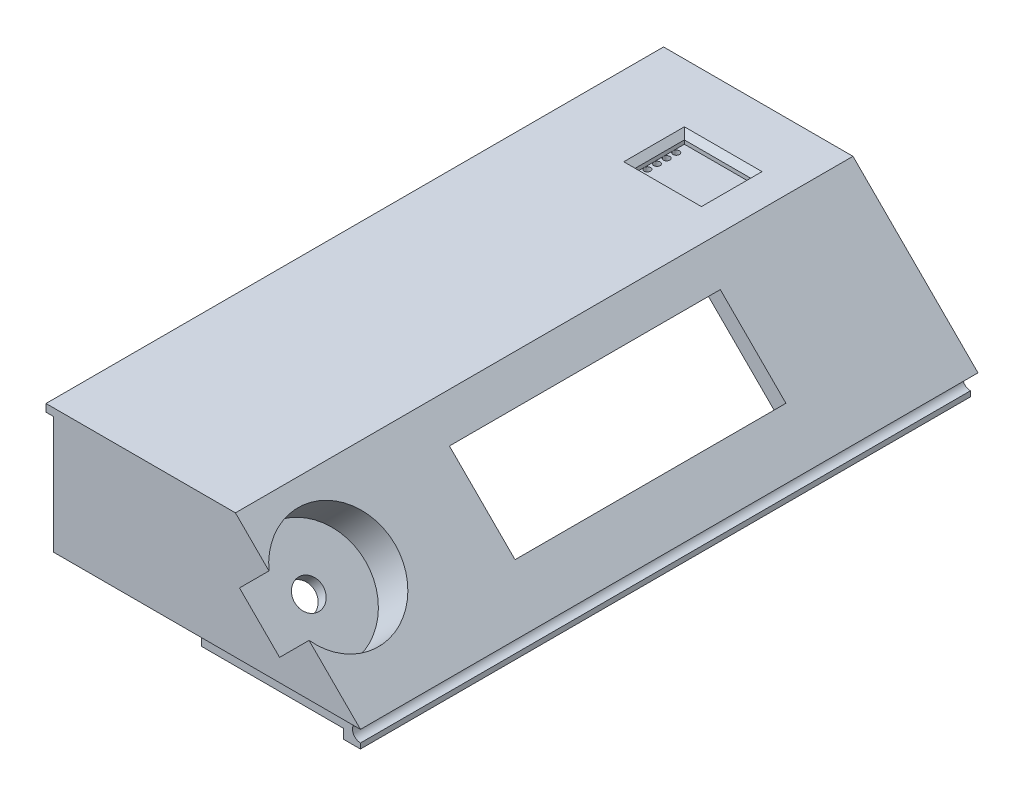
from build123d import *

# Parameters (mm, degrees)
EXTRUDE_1_DEPTH          = 163
EXTRUDE_2_DEPTH          = 2
EXTRUDE_3_DEPTH          = 2
SKETCH_4_W               = 37
SKETCH_4_H               = 10
EXTRUDE_4_DEPTH          = 2
SKETCH_5_W               = 71.5
SKETCH_5_H               = 24.5
CUT_EXTRUDE_1_DEPTH      = 186.248481775
SKETCH_6_W               = 79.5
SKETCH_6_H               = 32.5
SKETCH_6_W_2             = 71.5
SKETCH_6_H_2             = 24.5
EXTRUDE_5_DEPTH          = 3
EXTRUDE_6_DEPTH          = 79.5
SKETCH_10_R              = 15
CUT_EXTRUDE_2_DEPTH      = 14
EXTRUDE_8_DEPTH          = 14
SKETCH_12_R              = 3.75
EXTRUDE_9_DEPTH          = 3
CUT_EXTRUDE_3_DEPTH      = 186.137402806
CUT_EXTRUDE_3_DEPTH_BACK = 186.137402806
SKETCH_14_W              = 17.5
SKETCH_14_H              = 13
SKETCH_15_W              = 23.5
SKETCH_15_H              = 19
SKETCH_15_W_2            = 17.5
SKETCH_15_H_2            = 13
EXTRUDE_10_DEPTH         = 0.5
SKETCH_16_W              = 23.5
SKETCH_16_H              = 19
EXTRUDE_11_DEPTH         = 2
CHAMFER_2_SIZE           = 2
CHAMFER_3_SIZE           = 1.5
SKETCH_17_R              = 0.85
CUT_EXTRUDE_4_DEPTH      = 10
SKETCH_18_W              = 5
SKETCH_18_H              = 7
EXTRUDE_12_DEPTH         = 161
SKETCH_19_R              = 2.1
CUT_EXTRUDE_5_DEPTH      = 161
SKETCH_20_W              = 5
SKETCH_20_H              = 8
EXTRUDE_13_DEPTH         = 22
SKETCH_21_R              = 2.1
CUT_EXTRUDE_6_DEPTH      = 30.1
EXTRUDE_14_DEPTH         = 161
CUT_EXTRUDE_7_DEPTH      = 185.983783073
CUT_EXTRUDE_7_DEPTH_BACK = 185.983783073
SKETCH_23_R              = 2.1
EXTRUDE_15_DEPTH         = 2
EXTRUDE_16_DEPTH         = 6
FILLET_1_R               = 6
CHAMFER_5_SIZE           = 3
CHAMFER_5_SIZE2          = 5.196152423


with BuildPart() as part:
    # Эскиз1 → Бобышка-Вытянуть1 (new body)
    with BuildSketch(Plane.XY):
        Polygon((0, 0), (-31, 31), (-81, 31), (-81, 33), (-31, 33), (2, 0), align=None)
    extrude(amount=EXTRUDE_1_DEPTH)

    # Эскиз2 → Бобышка-Вытянуть2 (add)
    with BuildSketch(Plane.XY.offset(163)):
        Polygon((2, 0), (-31, 33), (-79, 33), (-79, 0), align=None)
    extrude(amount=-EXTRUDE_2_DEPTH)

    # Эскиз3 → Бобышка-Вытянуть3 (add)
    with BuildSketch(Plane(origin=(0, 0, 0), x_dir=(-1, 0, 0), z_dir=(0, 0, -1))):
        Polygon((0, 0), (31, 31), (79, 31), (79, 28), (32.242640687, 28), (4.242640687, 0), align=None)
    extrude(amount=-EXTRUDE_3_DEPTH)

    # Эскиз4 → Бобышка-Вытянуть4 (add)
    with BuildSketch(Plane.XZ):
        with Locations((-60.5, 156)):
            Rectangle(SKETCH_4_W, SKETCH_4_H)
    extrude(amount=-EXTRUDE_4_DEPTH)

    # Эскиз5 → Вырез-Вытянуть1 (cut, through all)
    with BuildSketch(Plane(origin=(1, 1, 0), x_dir=(0, 0, -1), z_dir=(0.7071067811865461, 0.7071067811865489, 0))):
        with Locations((-77.25, 23.840620434)):
            Rectangle(SKETCH_5_W, SKETCH_5_H)
    extrude(amount=-CUT_EXTRUDE_1_DEPTH, mode=Mode.SUBTRACT)

    # Эскиз6 → Бобышка-Вытянуть5 (add)
    with BuildSketch(Plane(origin=(0, 0, 0), x_dir=(0, 0, 1), z_dir=(-0.7071067811865462, -0.7071067811865489, 0))):
        with Locations((77.25, 23.840620434)):
            Rectangle(SKETCH_6_W, SKETCH_6_H)
        with Locations((77.25, 23.840620434)):
            Rectangle(SKETCH_6_W_2, SKETCH_6_H_2, mode=Mode.SUBTRACT)
    extrude(amount=EXTRUDE_5_DEPTH)

    # Эскиз8 → Бобышка-Вытянуть6 (add)
    with BuildSketch(Plane(origin=(0, 0, 37.5), x_dir=(-1, 0, 0), z_dir=(0, 0, -1))):
        Polygon((28.348349571, 28.348349571), (30.469669914, 26.227029227), (35.242640687, 31), (31, 31), align=None)
    extrude(amount=-EXTRUDE_6_DEPTH)

    # Эскиз10 → Вырез-Вытянуть2 (cut)
    with BuildSketch(Plane(origin=(1, 1, 0), x_dir=(0, 0, -1), z_dir=(0.7071067811865461, 0.7071067811865489, 0))):
        with Locations((-150, 25.254833996)):
            Circle(SKETCH_10_R)
    extrude(amount=-CUT_EXTRUDE_2_DEPTH, mode=Mode.SUBTRACT)

    # Эскиз11 → Бобышка-Вытянуть8 (add)
    with BuildSketch(Plane(origin=(1, 1, 0), x_dir=(0, 0, -1), z_dir=(0.7071067811865461, 0.7071067811865489, 0))):
        with BuildLine():
            Line((-163, 32.738148769), (-163, 35.738148769))
            ThreePointArc((-163, 35.738148769), (-133.299703936, 25.254833996), (-163, 14.771519222))
            Line((-163, 14.771519222), (-163, 17.771519222))
            ThreePointArc((-163, 17.771519222), (-135, 25.254833996), (-163, 32.738148769))
        make_face()
    extrude(amount=-EXTRUDE_8_DEPTH)

    # Эскиз12 → Бобышка-Вытянуть9 (add)
    with BuildSketch(Plane(origin=(-8.899494937, -8.899494937, 0), x_dir=(0, 0, -1), z_dir=(0.7071067811865461, 0.7071067811865489, 0))):
        with BuildLine():
            Line((-163, 35.737677122), (-163, 14.77199087))
            ThreePointArc((-163, 14.77199087), (-133.3, 25.254833996), (-163, 35.737677122))
        make_face()
        with Locations(Location((-150, 25.254833996, 0), (0, 0, 270))):
            Circle(SKETCH_12_R, mode=Mode.SUBTRACT)
    extrude(amount=EXTRUDE_9_DEPTH)

    # Эскиз14 → Вырез-Вытянуть3 (cut, two sides: drawn at the far end of the back side and taken through both)
    with BuildSketch(Plane.XZ.offset(-31).offset(-CUT_EXTRUDE_3_DEPTH_BACK)):
        with Locations((-49.75, 23.5)):
            Rectangle(SKETCH_14_W, SKETCH_14_H)
    extrude(amount=CUT_EXTRUDE_3_DEPTH + CUT_EXTRUDE_3_DEPTH_BACK, mode=Mode.SUBTRACT)

    # Эскиз15 → Бобышка-Вытянуть10 (add)
    with BuildSketch(Plane.XZ.offset(-31)):
        with Locations((-49.75, 23.5)):
            Rectangle(SKETCH_15_W, SKETCH_15_H)
        with Locations((-49.75, 23.5)):
            Rectangle(SKETCH_15_W_2, SKETCH_15_H_2, mode=Mode.SUBTRACT)
    extrude(amount=EXTRUDE_10_DEPTH)

    # Эскиз16 → Бобышка-Вытянуть11 (add)
    with BuildSketch(Plane.XZ.offset(-30.5)):
        with Locations((-49.75, 23.5)):
            Rectangle(SKETCH_16_W, SKETCH_16_H)
    extrude(amount=EXTRUDE_11_DEPTH)

    # Фаска2
    chamfer_2_edges = [part.edges().sort_by_distance(p)[0] for p in [
        (-38, 31, 23.5),
        (-49.75, 31, 33),
        (-61.5, 31, 23.5),
        (-49.75, 31, 14),
    ]]
    chamfer(chamfer_2_edges, length=CHAMFER_2_SIZE)

    # Фаска3
    chamfer_3_edges = [part.edges().sort_by_distance(p)[0] for p in [
        (-41, 33, 23.5),
        (-49.75, 33, 17),
        (-58.5, 33, 23.5),
        (-49.75, 33, 30),
    ]]
    chamfer(chamfer_3_edges, length=CHAMFER_3_SIZE)

    # Эскиз17 → Вырез-Вытянуть4 (cut)
    with BuildSketch(Plane(origin=(0, 30.5, 0), x_dir=(1, 0, 0), z_dir=(0, 1, 0))):
        with Locations(Location((-57.65, -20, 0), (0, 0, 270))):
            Circle(SKETCH_17_R)
        with Locations(Location((-57.65, -22.54, 0), (0, 0, 270))):
            Circle(SKETCH_17_R)
        with Locations(Location((-57.65, -25.08, 0), (0, 0, 270))):
            Circle(SKETCH_17_R)
        with Locations(Location((-57.65, -27.62, 0), (0, 0, 270))):
            Circle(SKETCH_17_R)
    extrude(amount=-CUT_EXTRUDE_4_DEPTH, mode=Mode.SUBTRACT)

    # Эскиз18 → Бобышка-Вытянуть12 (add)
    with BuildSketch(Plane(origin=(0, 0, 161), x_dir=(-1, 0, 0), z_dir=(0, 0, -1))):
        with Locations((76.5, 27.5)):
            Rectangle(SKETCH_18_W, SKETCH_18_H)
    extrude(amount=EXTRUDE_12_DEPTH)

    # Эскиз19 → Вырез-Вытянуть5 (cut)
    with BuildSketch(Plane(origin=(0, 0, 0), x_dir=(-1, 0, 0), z_dir=(0, 0, -1))):
        with Locations((79, 28)):
            Circle(SKETCH_19_R)
    extrude(amount=-CUT_EXTRUDE_5_DEPTH, mode=Mode.SUBTRACT)

    # Эскиз20 → Бобышка-Вытянуть13 (add)
    with BuildSketch(Plane.XZ.offset(-24)):
        with Locations((-76.5, 157)):
            Rectangle(SKETCH_20_W, SKETCH_20_H)
    extrude(amount=EXTRUDE_13_DEPTH)

    # Эскиз21 → Вырез-Вытянуть6 (cut)
    with BuildSketch(Plane.XZ):
        with Locations((-79, 159)):
            Circle(SKETCH_21_R)
    extrude(amount=-CUT_EXTRUDE_6_DEPTH, mode=Mode.SUBTRACT)

    # Эскиз22 → Бобышка-Вытянуть14 (add)
    with BuildSketch(Plane(origin=(0, 0, 161), x_dir=(-1, 0, 0), z_dir=(0, 0, -1))):
        Polygon((4.5, -1.5), (4.5, 4.5), (0, 0), (0, -6.5), (4.5, -6.5), align=None)
    extrude(amount=EXTRUDE_14_DEPTH)

    # Эскиз23 → Вырез-Вытянуть7 (cut, two sides: drawn at the far end of the back side and taken through both)
    with BuildSketch(Plane(origin=(0, 0, 0), x_dir=(-1, 0, 0), z_dir=(0, 0, -1)).offset(-CUT_EXTRUDE_7_DEPTH_BACK)):
        with Locations((0, -3)):
            Circle(SKETCH_23_R)
    extrude(amount=CUT_EXTRUDE_7_DEPTH + CUT_EXTRUDE_7_DEPTH_BACK, mode=Mode.SUBTRACT)

    # Эскиз24 → Бобышка-Вытянуть15 (add)
    with BuildSketch(Plane(origin=(0, 0, 0), x_dir=(-1, 0, 0), z_dir=(0, 0, -1))):
        Polygon((74, 24), (74, 28), (32.242640687, 28), (4.5, 0.257359313), (4.5, -3.742640687), (32.242640687, 24), align=None)
    extrude(amount=-EXTRUDE_15_DEPTH)

    # Эскиз25 → Бобышка-Вытянуть16 (add)
    with BuildSketch(Plane(origin=(0, 2, 0), x_dir=(1, 0, 0), z_dir=(0, 1, 0))):
        Polygon((-42, -151), (-79, -151), (-79, -149), (-40, -149), (-40, -159), (-4.5, -159), (-4.5, -161), (-42, -161), align=None)
    extrude(amount=-EXTRUDE_16_DEPTH)

    # Скругление1
    fillet_1_edges = [part.edges().sort_by_distance(p)[0] for p in [
        (-40, -1, 149),
    ]]
    fillet(fillet_1_edges, radius=FILLET_1_R)

    # Фаска5
    chamfer_5_edges = [part.edges().sort_by_distance(p)[0] for p in [
        (-46.899494937, 2, 161),
    ]]
    chamfer_5_side = [part.faces().sort_by_distance(p)[0] for p in [
        (-55.732444542, 2, 155.342995901),
    ]]
    chamfer(chamfer_5_edges, length=CHAMFER_5_SIZE, length2=CHAMFER_5_SIZE2, reference=chamfer_5_side[0])


solid = part.part
